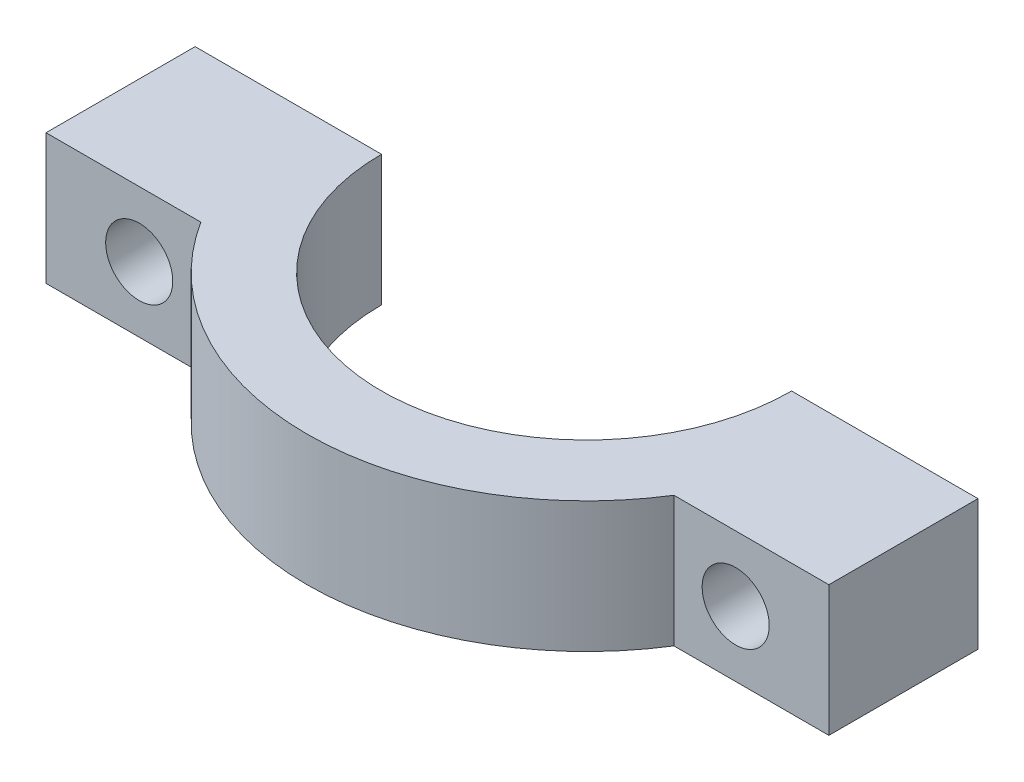
from build123d import *

# Parameters (mm, degrees)
BOSS_EXTRUDE1_DEPTH = 7
SKETCH4_R           = 1.8
CUT_EXTRUDE3_DEPTH  = 27.739483914


with BuildPart() as part:
    # Sketch3 → Boss-Extrude1 (new body)
    with BuildSketch(Plane(origin=(0, 0, 0), x_dir=(1, 0, 0), z_dir=(0, 1, 0))):
        with BuildLine():
            Line((-11, 0), (-21, 0))
            Line((-21, 0), (-21, -8))
            Line((-21, -8), (-12.68857754, -8))
            ThreePointArc((-12.68857754, -8), (0, -15), (12.68857754, -8))
            Line((12.68857754, -8), (21, -8))
            Line((21, -8), (21, 0))
            Line((21, 0), (11, 0))
            ThreePointArc((11, 0), (0, -11), (-11, 0))
        make_face()
    extrude(amount=BOSS_EXTRUDE1_DEPTH)

    # Sketch4 → Cut-Extrude3 (cut, symmetric)
    with BuildSketch(Plane.XY):
        with Locations(Location((16, 3.5, 0), (0, 0, 180))):
            Circle(SKETCH4_R)
    cut_extrude3 = extrude(amount=CUT_EXTRUDE3_DEPTH, both=True, mode=Mode.SUBTRACT)

    # Mirror1: Cut-Extrude3 across plane
    add(cut_extrude3.mirror(Plane(origin=(0, 0, 0), x_dir=(0, 0, 1), z_dir=(1, 0, 0))), mode=Mode.SUBTRACT)


solid = part.part
